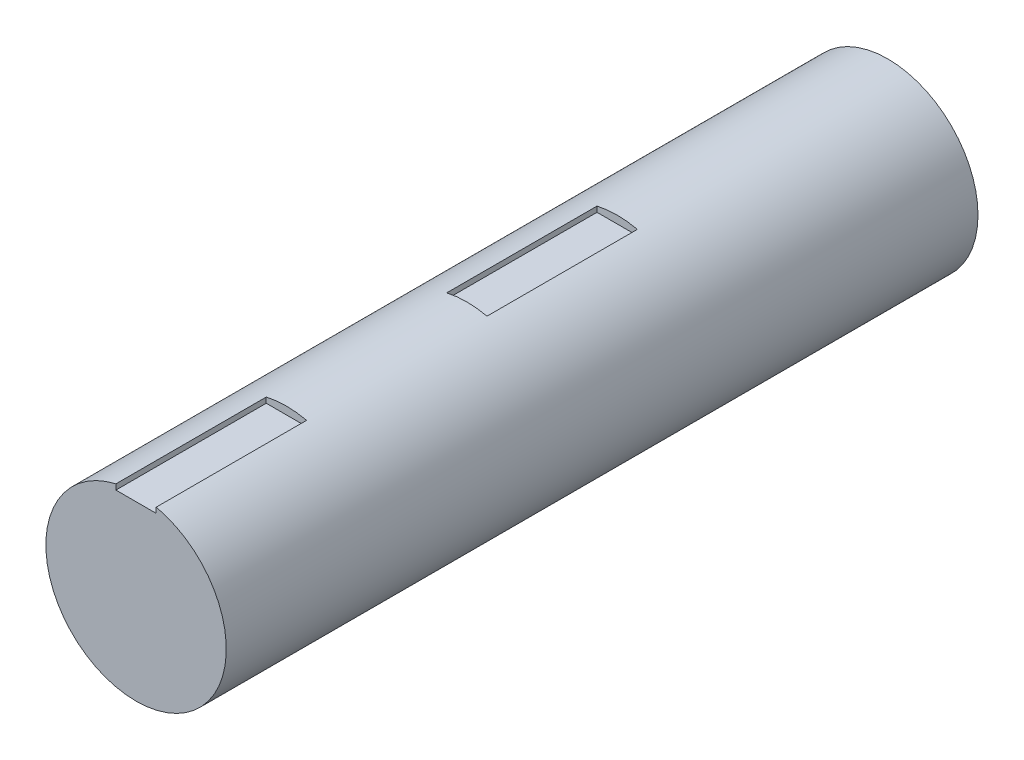
from build123d import *

# Parameters (mm, degrees)
SKETCH1_R           = 30
BOSS_EXTRUDE1_DEPTH = 125
SKETCH2_W           = 13.419524584
SKETCH2_H           = 7
CUT_EXTRUDE1_DEPTH  = 50
SKETCH3_W           = 13.419524584
SKETCH3_H           = 7
CUT_EXTRUDE2_DEPTH  = 50


with BuildPart() as part:
    # Sketch1 → Boss-Extrude1 (new, symmetric)
    with BuildSketch(Plane.XY):
        Circle(SKETCH1_R)
    extrude(amount=BOSS_EXTRUDE1_DEPTH, both=True)

    # Sketch2 → Cut-Extrude1 (cut)
    with BuildSketch(Plane.XY.offset(125)):
        with Locations((0, 30.94)):
            Rectangle(SKETCH2_W, SKETCH2_H)
    extrude(amount=-CUT_EXTRUDE1_DEPTH, mode=Mode.SUBTRACT)

    # Sketch3 → Cut-Extrude2 (cut)
    with BuildSketch(Plane.XY.offset(15)):
        with Locations((0, 30.94)):
            Rectangle(SKETCH3_W, SKETCH3_H)
    extrude(amount=-CUT_EXTRUDE2_DEPTH, mode=Mode.SUBTRACT)


solid = part.part
